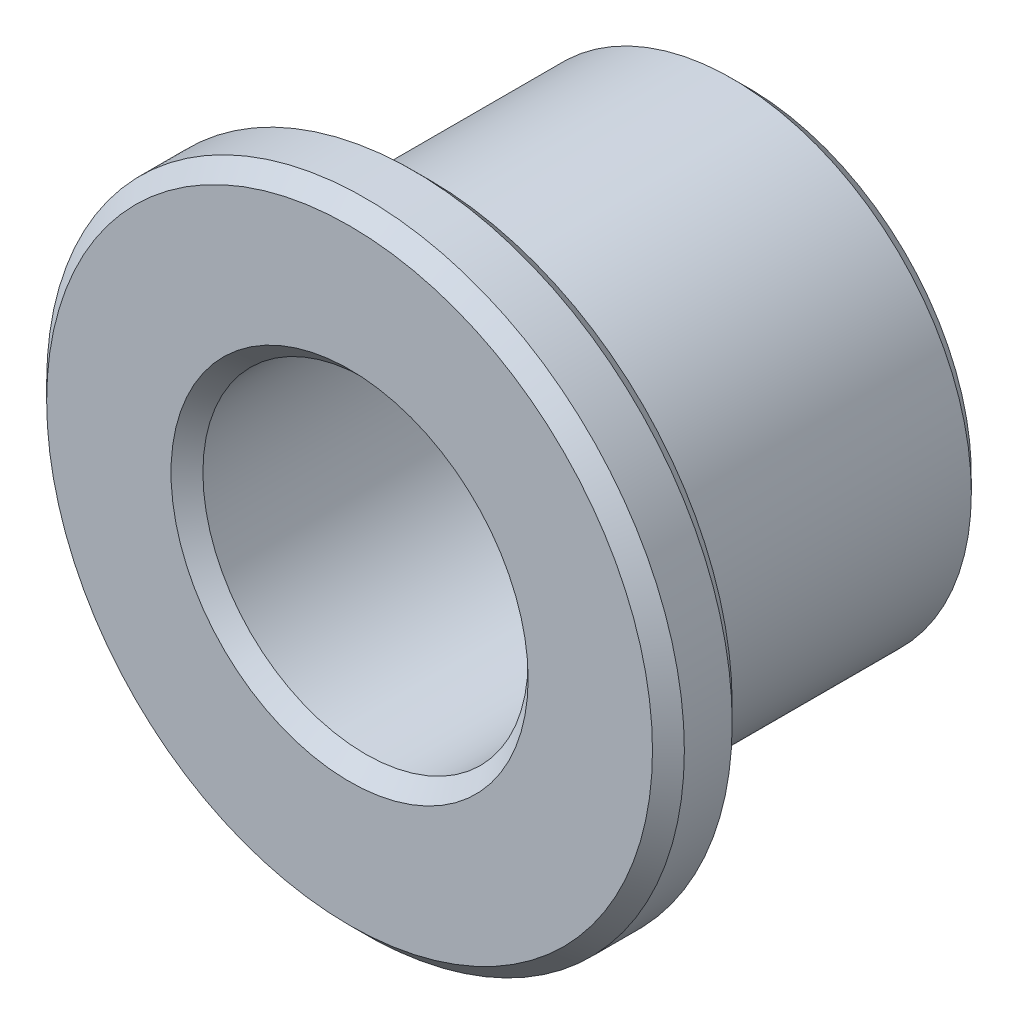
from build123d import *

# Parameters (mm, degrees)
CUT_EXTRUDE1_REACH = 25.971
SKETCH16_R         = 6.477
CHAMFER1_SIZE      = 0.635


with BuildPart() as part:
    # Sketch1 → Revolve1 (revolve)
    with BuildSketch(Plane(origin=(0, 0, 0), x_dir=(0, 0, -1), z_dir=(1, 0, 0))):
        Polygon((0, 0), (0, 12.7), (3.175, 12.7), (3.175, 9.525), (15.875, 9.525), (15.875, 0), align=None)
    revolve(axis=Axis((0, 0, 0), (0, 0, 1)))

    # Sketch16 → Cut-Extrude1 (cut, up to next)
    with BuildSketch(Plane.XY, mode=Mode.PRIVATE) as cut_extrude1_sk1:
        Circle(SKETCH16_R)
    cut_extrude1_tool1 = extrude(cut_extrude1_sk1.sketch, amount=-CUT_EXTRUDE1_REACH, mode=Mode.PRIVATE) & part.part
    add(cut_extrude1_tool1.solids().sort_by_distance((0, 0, 0))[0], mode=Mode.SUBTRACT)

    # Chamfer1
    chamfer1_edges = [part.edges().sort_by_distance(p)[0] for p in [
        (0, -9.525, -3.175),
        (0, -12.7, -3.175),
        (-6.477, 0, -15.875),
        (-6.477, 0, 0),
        (0, -9.525, -15.875),
        (0, -12.7, 0),
    ]]
    chamfer(chamfer1_edges, length=CHAMFER1_SIZE)


solid = part.part
